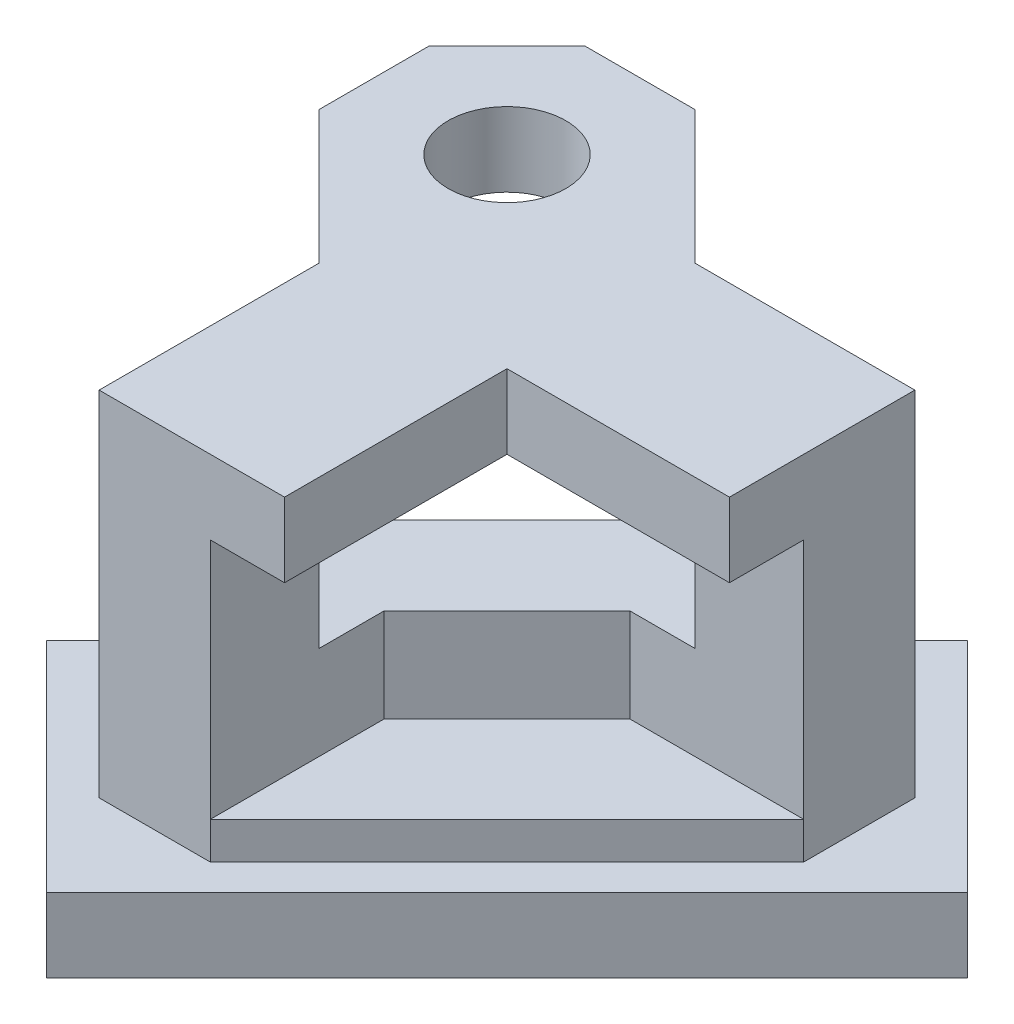
from build123d import *

# Parameters (mm, degrees)
SKETCH1_R           = 3.175
BOSS_EXTRUDE1_DEPTH = 4
BOSS_EXTRUDE2_DEPTH = 8
BOSS_EXTRUDE3_DEPTH = 5.05
BOSS_EXTRUDE4_DEPTH = 2
BOSS_EXTRUDE5_DEPTH = 4


with BuildPart() as part:
    # Sketch1 → Boss-Extrude1 (new body)
    with BuildSketch(Plane(origin=(0, 0, 0), x_dir=(1, 0, 0), z_dir=(0, 1, 0))):
        Polygon((-11, -11), (-1, -11), (-1, 1), (11, 1), (11, 11), (-0.85301769, 11), (-8.02801769, 18.175), (-13.97198231, 18.175), (-18.175, 13.97198231), (-18.175, 8.02801769), (-11, 0.85301769), align=None)
        with Locations(Location((-11, 11, 0), (0, 0, 270))):
            Circle(SKETCH1_R, mode=Mode.SUBTRACT)
    extrude(amount=-BOSS_EXTRUDE1_DEPTH)

    # Sketch2 → Boss-Extrude2 (add)
    with BuildSketch(Plane.XZ.offset(4)):
        Polygon((-0.85301769, -11), (11, -11), (11, -5), (5.14698231, -5), align=None)
        Polygon((-11, -0.85301769), (-11, 11), (-5, 11), (-5, 5.14698231), align=None)
    extrude(amount=BOSS_EXTRUDE2_DEPTH)

    # Sketch3 → Boss-Extrude3 (add)
    with BuildSketch(Plane.XZ.offset(12)):
        Polygon((-0.85301769, -11), (11, -11), (11, -5), (5.14698231, -5), (1.632263684, -5), (-5, 1.632263684), (-5, 5.14698231), (-5, 11), (-11, 11), (-11, -0.85301769), align=None)
    extrude(amount=BOSS_EXTRUDE3_DEPTH)

    # Sketch4 → Boss-Extrude4 (add)
    with BuildSketch(Plane.XZ.offset(17.05)):
        Polygon((-5, 11), (-11, 11), (-11, -0.85301769), (-0.85301769, -11), (11, -11), (11, -5), align=None)
    extrude(amount=BOSS_EXTRUDE4_DEPTH)

    # Sketch5 → Boss-Extrude5 (add)
    with BuildSketch(Plane.XZ.offset(19.05)):
        Polygon((-19.75493597, 5.073491155), (5.073491155, -19.75493597), (16.828427125, -8), (-8, 16.828427125), align=None)
    extrude(amount=BOSS_EXTRUDE5_DEPTH)


solid = part.part
